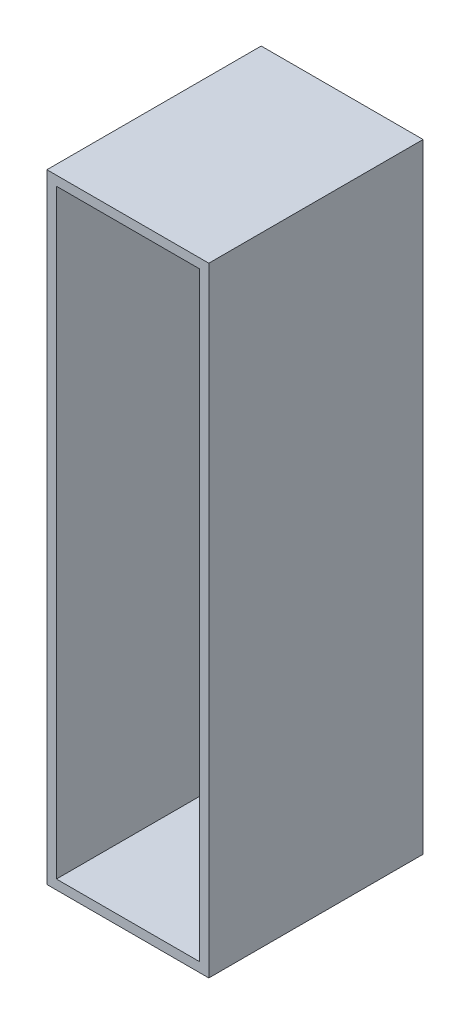
from build123d import *

# Parameters (mm, degrees)
SKETCH1_W     = 34
SKETCH1_H     = 130
SKETCH1_W_2   = 30
SKETCH1_H_2   = 126
PROFILE_DEPTH = 45
SKETCH2_W     = 30
SKETCH2_H     = 126
BACK_DEPTH    = 2


with BuildPart() as part:
    # Sketch1 → Profile (new body)
    with BuildSketch(Plane.XY):
        with Locations((17, 65)):
            Rectangle(SKETCH1_W, SKETCH1_H)
        with Locations((17, 65)):
            Rectangle(SKETCH1_W_2, SKETCH1_H_2, mode=Mode.SUBTRACT)
    extrude(amount=PROFILE_DEPTH)

    # Sketch2 → Back (add)
    with BuildSketch(Plane.XY):
        with Locations((17, 65)):
            Rectangle(SKETCH2_W, SKETCH2_H)
    extrude(amount=BACK_DEPTH)


solid = part.part
